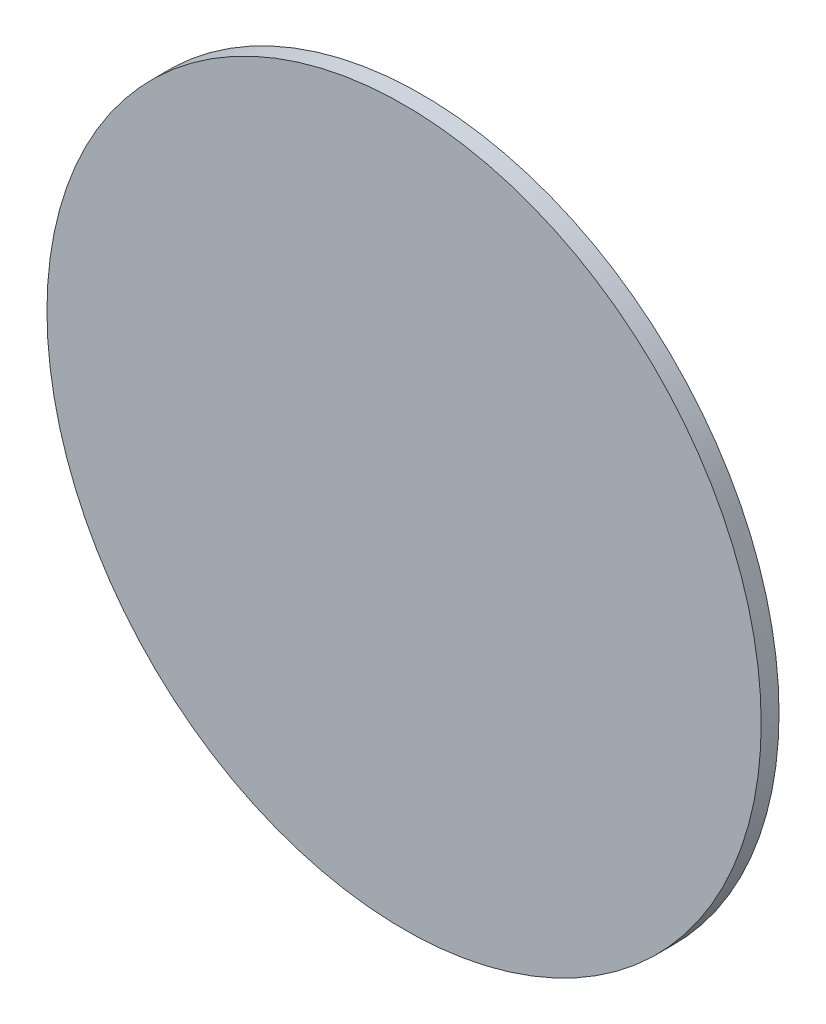
from build123d import *

# Parameters (mm, degrees)
SKETCH13_R          = 50.8
BOSS_EXTRUDE2_DEPTH = 2.54


with BuildPart() as part:
    # Sketch13 → Boss-Extrude2 (new body)
    with BuildSketch(Plane.XY):
        Circle(SKETCH13_R)
    extrude(amount=BOSS_EXTRUDE2_DEPTH)


solid = part.part
